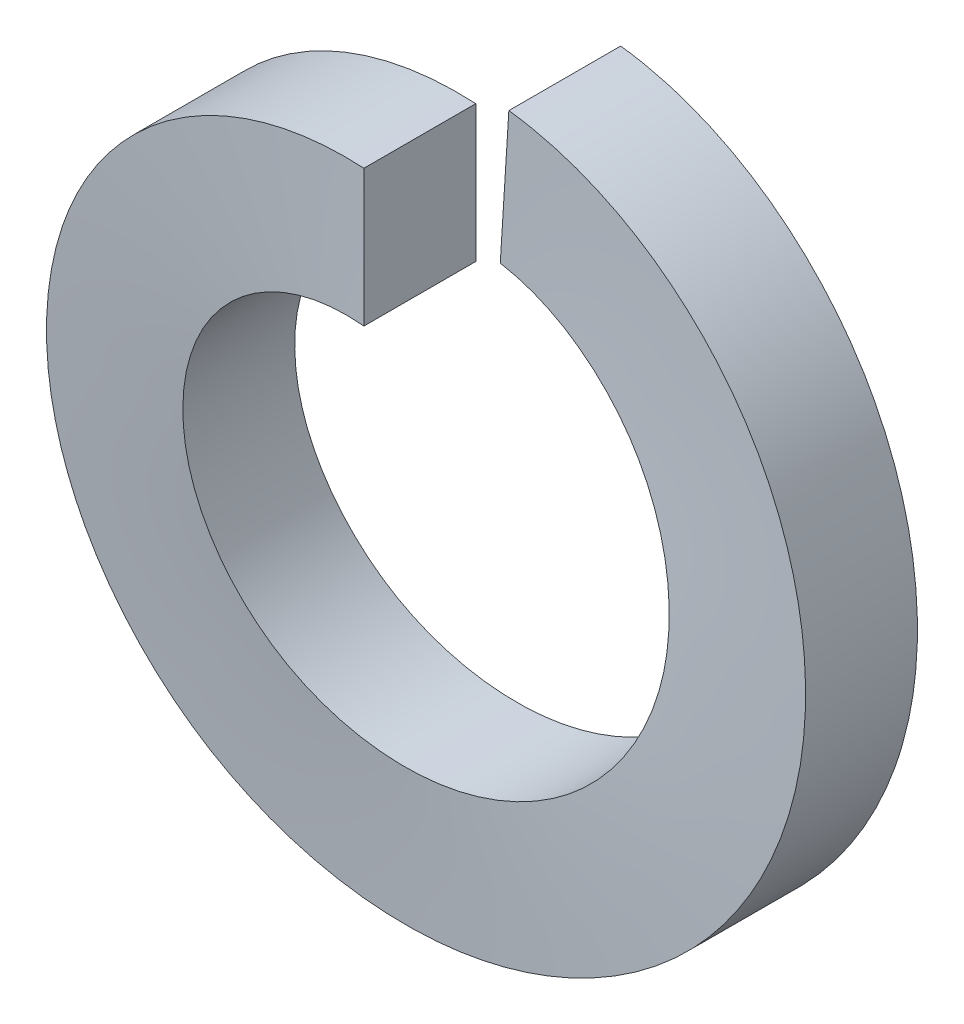
from build123d import *

# Parameters (mm, degrees)
SWEEP1_PITCH       = 1
SWEEP1_HEIGHT      = 0.99
SWEEP1_RADIUS      = 2.8
SWEEP1_START_ANGLE = 90
SKETCH2_W          = 0.9
SKETCH2_H          = 1.1


with BuildPart() as part:
    # Sweep1: sweep along a helix
    with BuildLine() as sweep1_path:
        add(Helix(SWEEP1_PITCH, SWEEP1_HEIGHT, SWEEP1_RADIUS, center=(0, 0, 0), direction=(0, 0, -1), lefthand=True, mode=Mode.PRIVATE).rotate(Axis((0, 0, 0), (0, 0, -1)), SWEEP1_START_ANGLE))
    # Sketch2 → Sweep1 (sweep)
    with BuildSketch(Plane(origin=(0, 0, 0), x_dir=(0, 0, -1), z_dir=(1, 0, 0))):
        with Locations((-0.45, 2.25)):
            Rectangle(SKETCH2_W, SKETCH2_H)
    sweep(path=sweep1_path.line, is_frenet=True)


solid = part.part
